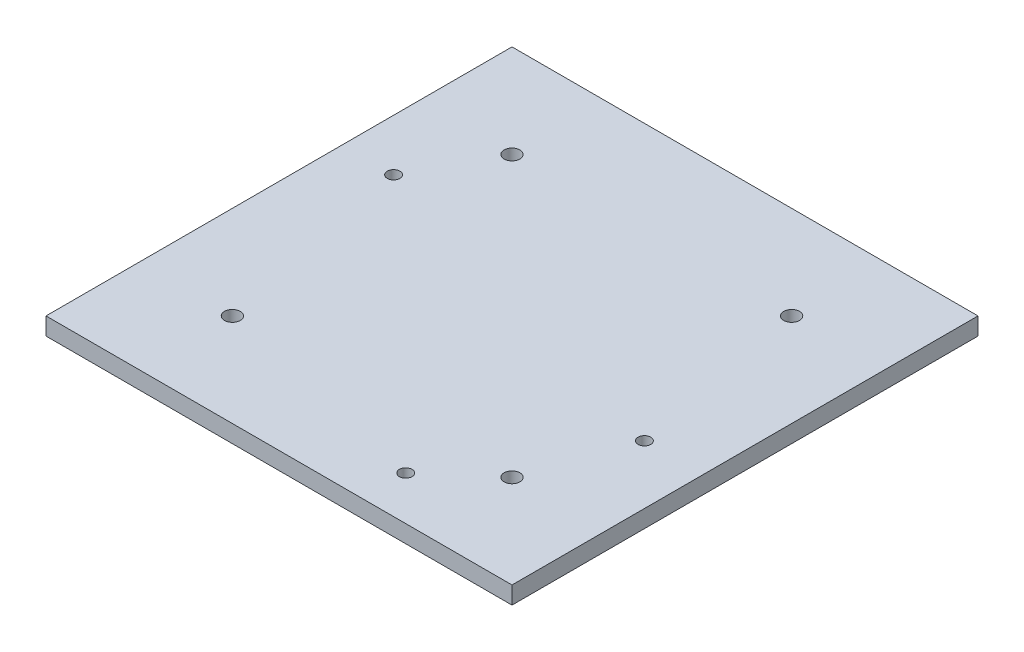
from build123d import *

# Parameters (mm, degrees)
SKETCH1_W                    = 127
SKETCH1_H                    = 127
BOSS_EXTRUDE1_DEPTH          = 4.7625
SKETCH3_R                    = 1.7272
CUT_EXTRUDE2_DEPTH           = 134.260815846
F_18_0_1695_DIAMETER_HOLE1_D = 4.3053


with BuildPart() as part:
    # Sketch1 → Boss-Extrude1 (new body)
    with BuildSketch(Plane(origin=(0, 0, 0), x_dir=(1, 0, 0), z_dir=(0, 1, 0))):
        with Locations((-42.83649213, 16.676767677)):
            Rectangle(SKETCH1_W, SKETCH1_H)
    extrude(amount=BOSS_EXTRUDE1_DEPTH)

    # Sketch3 → Cut-Extrude2 (cut, through all)
    with BuildSketch(Plane(origin=(0, 4.7625, 0), x_dir=(1, 0, 0), z_dir=(0, 1, 0))):
        with Locations(Location((-92.281344473, 33.850048251, 0), (0, 0, 270))):
            Circle(SKETCH3_R)
        with Locations(Location((4.680777484, 5.250408923, 0), (0, 0, 270))):
            Circle(SKETCH3_R)
        with Locations(Location((-20.243685744, -34.883948787, 0), (0, 0, 270))):
            Circle(SKETCH3_R)
    extrude(amount=-CUT_EXTRUDE2_DEPTH, mode=Mode.SUBTRACT)

    # #18 (0.1695) Diameter Hole1 (through all)
    with Locations(Plane(origin=(0, 0, 0), x_dir=(-1, 0, 0), z_dir=(0, -1, 0))):
        with Locations((80.93649213, -21.423232323), (80.93649213, 54.776767677), (4.73649213, -21.423232323), (4.73649213, 54.776767677)):
            Hole(F_18_0_1695_DIAMETER_HOLE1_D / 2)


solid = part.part
